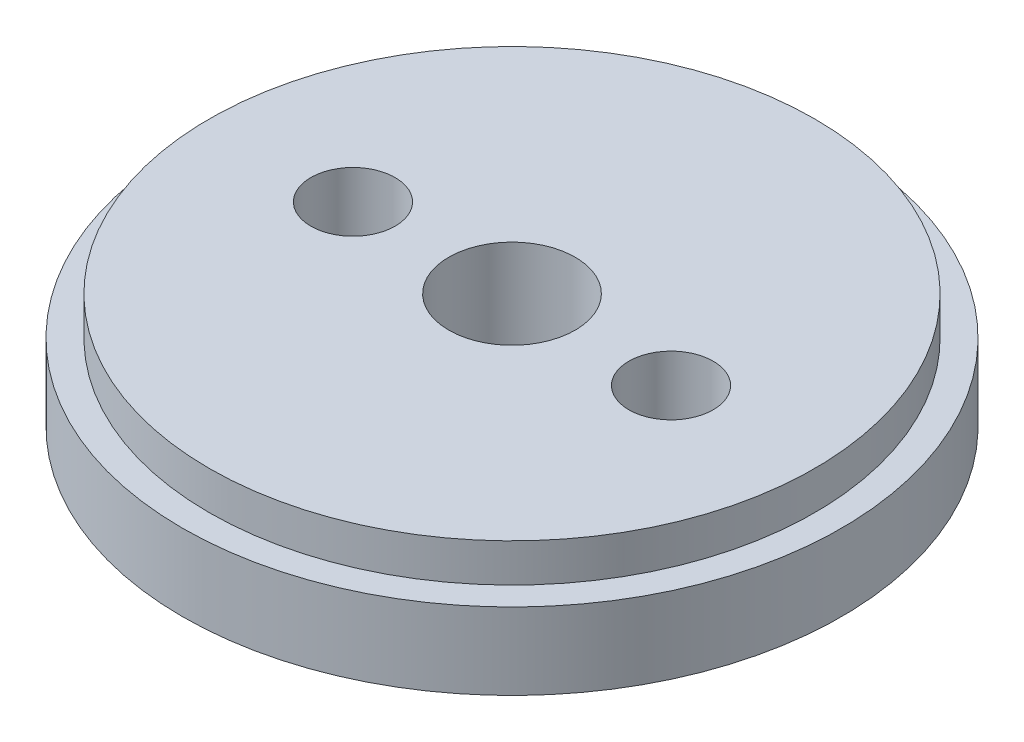
from build123d import *

# Parameters (mm, degrees)
SKETCH1_R           = 17.2
BOSS_EXTRUDE1_DEPTH = 6
SKETCH2_OUTSIDE_W   = 46.204
SKETCH2_OUTSIDE_H   = 46.204
SKETCH2_OUTSIDE_R   = 15.8
CUT_EXTRUDE1_DEPTH  = 2
SKETCH3_R           = 3.3
SKETCH3_R_2         = 2.2
CUT_EXTRUDE2_DEPTH  = 26.053542664


with BuildPart() as part:
    # Sketch1 → Boss-Extrude1 (new body)
    with BuildSketch(Plane(origin=(0, 0, 0), x_dir=(1, 0, 0), z_dir=(0, 1, 0))):
        with Locations(Location((0, 0, 0), (0, 0, 270))):
            Circle(SKETCH1_R)
    extrude(amount=BOSS_EXTRUDE1_DEPTH)

    # Sketch2 outside → Cut-Extrude1 (cut)
    with BuildSketch(Plane(origin=(0, 6, 0), x_dir=(1, 0, 0), z_dir=(0, 1, 0))):
        Rectangle(SKETCH2_OUTSIDE_W, SKETCH2_OUTSIDE_H)
        with Locations(Location((0, 0, 0), (0, 0, 270))):
            Circle(SKETCH2_OUTSIDE_R, mode=Mode.SUBTRACT)
    extrude(amount=-CUT_EXTRUDE1_DEPTH, mode=Mode.SUBTRACT)

    # Sketch3 → Cut-Extrude2 (cut, through all)
    with BuildSketch(Plane(origin=(0, 6, 0), x_dir=(1, 0, 0), z_dir=(0, 1, 0))):
        with Locations(Location((0, 0, 0), (0, 0, 270))):
            Circle(SKETCH3_R)
        with Locations(Location((-8.3, 0, 0), (0, 0, 270))):
            Circle(SKETCH3_R_2)
        with Locations(Location((8.3, 0, 0), (0, 0, 270))):
            Circle(SKETCH3_R_2)
    extrude(amount=-CUT_EXTRUDE2_DEPTH, mode=Mode.SUBTRACT)


solid = part.part
